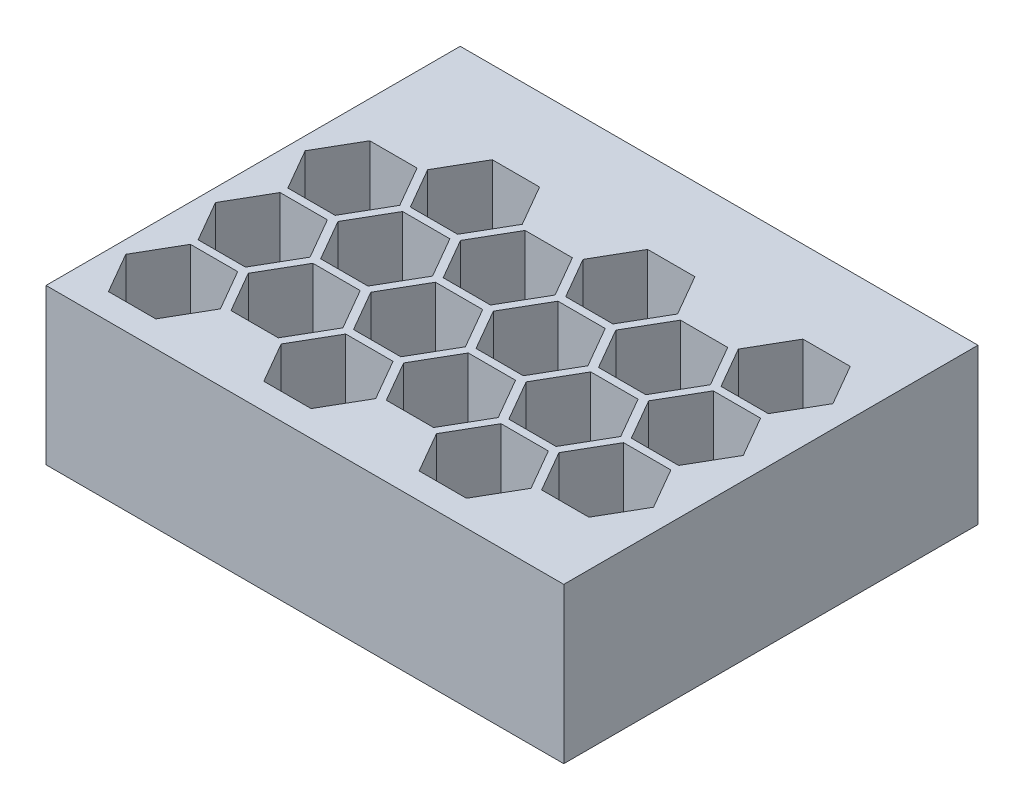
from build123d import *

# Parameters (mm, degrees)
SKETCH1_W            = 10
SKETCH1_H            = 8
BOSS_EXTRUDE1_DEPTH  = 3
CUT_EXTRUDE1_REACH   = 15.153
LPATTERN2_COUNT      = 3
LPATTERN2_PITCH      = 3
LPATTERN2_COUNT_DIR2 = 3
LPATTERN2_PITCH_DIR2 = 1.732050808


with BuildPart() as part:
    # Sketch1 → Boss-Extrude1 (new body)
    with BuildSketch(Plane(origin=(0, 0, 0), x_dir=(1, 0, 0), z_dir=(0, 1, 0))):
        with Locations((5, 4)):
            Rectangle(SKETCH1_W, SKETCH1_H)
    extrude(amount=BOSS_EXTRUDE1_DEPTH)

    # Sketch2 → Cut-Extrude1 (cut, up to next)
    with BuildSketch(Plane(origin=(0, 3, 0), x_dir=(1, 0, 0), z_dir=(0, 1, 0)), mode=Mode.PRIVATE) as cut_extrude1_sk1:
        Polygon((2.076794919, 1.291025404), (1.620096189, 2.082050808), (0.70669873, 2.082050808), (0.25, 1.291025404), (0.70669873, 0.5), (1.620096189, 0.5), align=None)
    cut_extrude1_tool1 = extrude(cut_extrude1_sk1.sketch, amount=-CUT_EXTRUDE1_REACH, mode=Mode.PRIVATE) & part.part
    # Sketch2 → Cut-Extrude1 (cut, up to next)
    with BuildSketch(Plane(origin=(0, 3, 0), x_dir=(1, 0, 0), z_dir=(0, 1, 0)), mode=Mode.PRIVATE) as cut_extrude1_sk2:
        Polygon((3.576794919, 2.157050808), (3.120096189, 2.948076211), (2.20669873, 2.948076211), (1.75, 2.157050808), (2.20669873, 1.366025404), (3.120096189, 1.366025404), align=None)
    cut_extrude1_tool2 = extrude(cut_extrude1_sk2.sketch, amount=-CUT_EXTRUDE1_REACH, mode=Mode.PRIVATE) & part.part
    cut_extrude1_1 = cut_extrude1_tool1.solids().sort_by_distance((1.163397, 3, -1.291025))[0]
    add(cut_extrude1_1, mode=Mode.SUBTRACT)
    cut_extrude1_2 = cut_extrude1_tool2.solids().sort_by_distance((2.663397, 3, -2.157051))[0]
    add(cut_extrude1_2, mode=Mode.SUBTRACT)
    cut_extrude1 = cut_extrude1_1 + cut_extrude1_2  # Cut-Extrude1 as one shape, for the pattern or mirror that repeats it

    # LPattern2: Cut-Extrude1 3 × 3
    with Locations(*[(i * LPATTERN2_PITCH, 0, -j * LPATTERN2_PITCH_DIR2) for i in range(LPATTERN2_COUNT) for j in range(LPATTERN2_COUNT_DIR2) if (i, j) != (0, 0)]):
        add(cut_extrude1, mode=Mode.SUBTRACT)


solid = part.part
